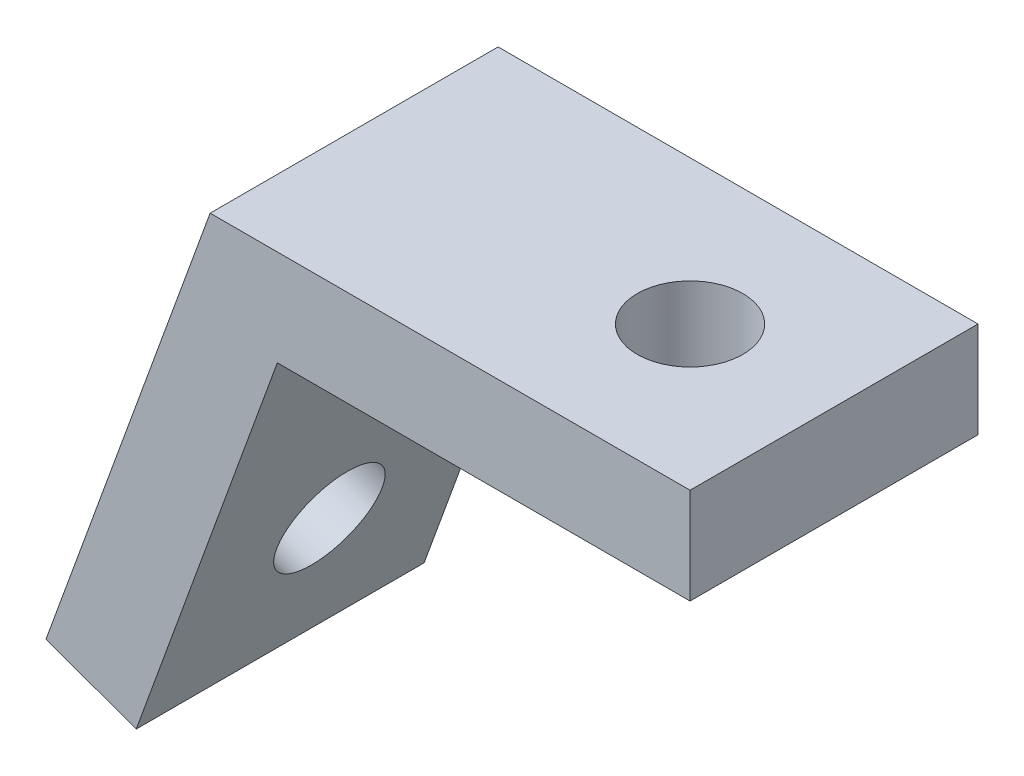
from build123d import *

# Parameters (mm, degrees)
BOSS_EXTRUDE1_DEPTH = 6
SKETCH2_R           = 1.1
CUT_EXTRUDE1_DEPTH  = 6
SKETCH3_R           = 1.1
CUT_EXTRUDE2_DEPTH  = 6


with BuildPart() as part:
    # Sketch1 → Boss-Extrude1 (new body)
    with BuildSketch(Plane.XY):
        Polygon((7.084804736, 1.368917583), (-2.915195264, 1.368917583), (-6.335396697, -8.028008625), (-4.456011456, -8.712048911), (-1.514780188, -0.631082417), (7.084804736, -0.631082417), align=None)
    extrude(amount=BOSS_EXTRUDE1_DEPTH)

    # Sketch2 → Cut-Extrude1 (cut)
    with BuildSketch(Plane(origin=(0, 1.368917583, 0), x_dir=(1, 0, 0), z_dir=(0, 1, 0))):
        with Locations(Location((4.084804736, -3, 0), (0, 0, 180))):
            Circle(SKETCH2_R)
    extrude(amount=-CUT_EXTRUDE1_DEPTH, mode=Mode.SUBTRACT)

    # Sketch3 → Cut-Extrude2 (cut)
    with BuildSketch(Plane(origin=(-3.014143829, 1.097058636, 0), x_dir=(0, 0, 1), z_dir=(-0.9396926207859095, 0.34202014332566544, 0))):
        with Locations(Location((3, -6.710693751, 0), (0, 0, 270))):
            Circle(SKETCH3_R)
    extrude(amount=-CUT_EXTRUDE2_DEPTH, mode=Mode.SUBTRACT)


solid = part.part
